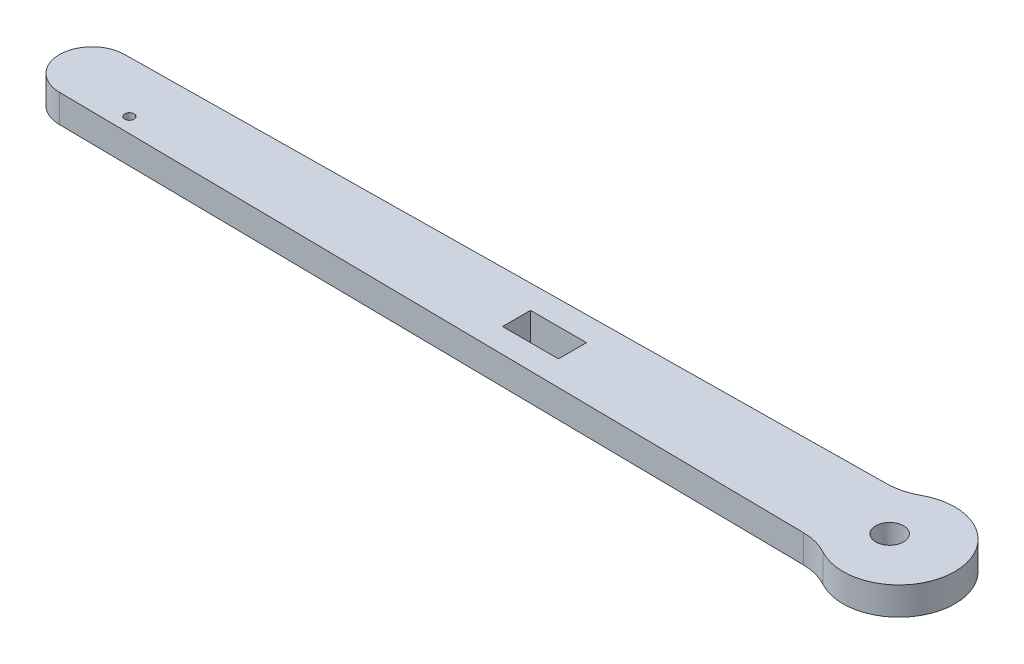
from build123d import *

# Parameters (mm, degrees)
CROQUIS1_R                 = 0.5
CROQUIS1_R_2               = 1.5
CROQUIS1_W                 = 6
CROQUIS1_H                 = 3
SALIENTE_EXTRUIR1_DEPTH    = 3
S_LIDO_MOVER_COPIAR1_ANGLE = 90


with BuildPart() as part:
    # Croquis1 → Saliente-Extruir1 (new body)
    with BuildSketch(Plane.XY):
        with BuildLine():
            Line((41811.264601562, -420.544949858), (41892.031527809, -419.541772165))
            ThreePointArc((41892.031527809, -419.541772165), (41893.493281322, -419.343004838), (41894.86235293, -418.793573574))
            ThreePointArc((41894.86235293, -418.793573574), (41903.764601562, -424.044949858), (41894.86235293, -429.296326142))
            ThreePointArc((41894.86235293, -429.296326142), (41893.493281322, -428.746894878), (41892.031527809, -428.548127552))
            Line((41892.031527809, -428.548127552), (41811.264601555, -427.544949858))
            ThreePointArc((41811.264601555, -427.544949858), (41807.764601562, -424.044949855), (41811.264601562, -420.544949858))
        make_face()
        with Locations((41817.264601562, -426.044949857)):
            Circle(CROQUIS1_R, mode=Mode.SUBTRACT)
        with Locations((41896.764601562, -424.044949858)):
            Circle(CROQUIS1_R_2, mode=Mode.SUBTRACT)
        with Locations((41859.764601562, -424.044949858)):
            Rectangle(CROQUIS1_W, CROQUIS1_H, mode=Mode.SUBTRACT)
    extrude(amount=SALIENTE_EXTRUIR1_DEPTH)


with BuildPart() as part_1:
    # Sólido-Mover/Copiar1: moved
    add(part.part.rotate(Axis((0, -424.044949858, 1.5), (-1, 0, 0)), S_LIDO_MOVER_COPIAR1_ANGLE))


solid = part_1.part
